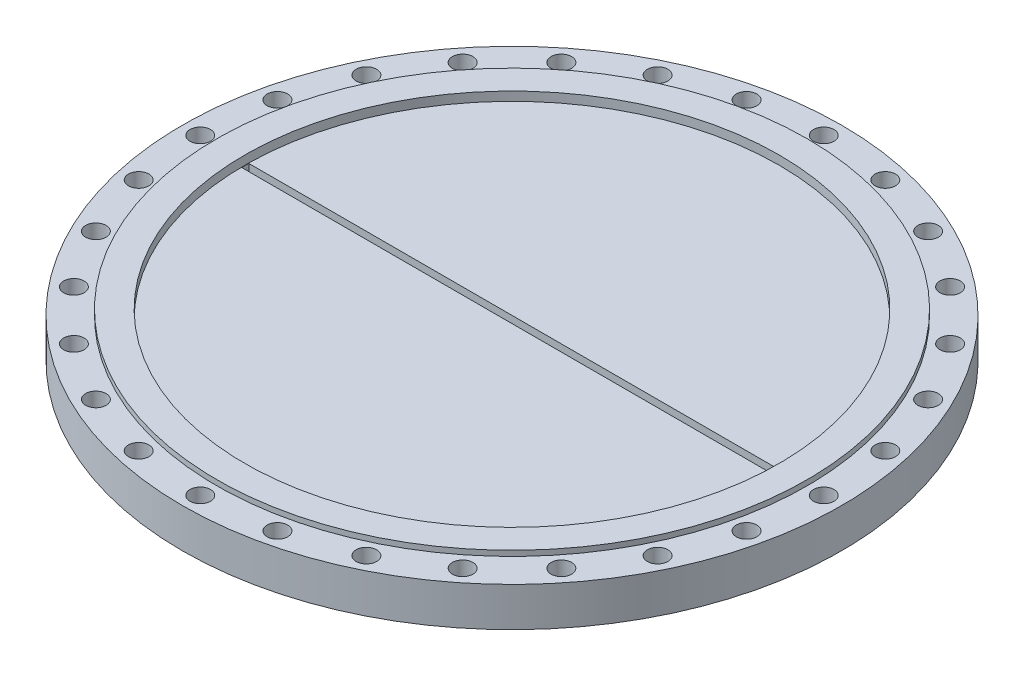
from build123d import *

# Parameters (mm, degrees)
SKETCH_2_R          = 11.5
CUT_EXTRUDE_1_DEPTH = 526.105703645
SKETCH_3_W          = 599
SKETCH_3_H          = 8
CUT_EXTRUDE_2_DEPTH = 10


with BuildPart() as part:
    # Эскиз1 → Повернуть1 (revolve)
    with BuildSketch(Plane.XY, mode=Mode.PRIVATE) as revolve_1_sk:
        Polygon((-300, 50), (-331.5, 50), (-331.5, 44), (-370, 44), (-370, 0), (0, 0), (0, 40), (-300, 40), align=None)
    revolve(revolve_1_sk.sketch.rotate(Axis((0, 0, 0), (0, 1, 0)), 270), axis=Axis((0, 0, 0), (0, 1, 0)))

    # Эскиз2 → Вырез-Вытянуть1 (cut, through all)
    with BuildSketch(Plane(origin=(0, 44, 0), x_dir=(1, 0, 0), z_dir=(0, 1, 0))):
        with Locations(Location((0, 350, 0), (0, 0, 270))):
            Circle(SKETCH_2_R)
        with Locations(Location((77.882326885, 341.224769264, 0), (0, 0, 270))):
            Circle(SKETCH_2_R)
        with Locations(Location((151.859308691, 315.339103766, 0), (0, 0, 270))):
            Circle(SKETCH_2_R)
        with Locations(Location((218.221430651, 273.641018864, 0), (0, 0, 270))):
            Circle(SKETCH_2_R)
        with Locations(Location((273.641018864, 218.221430651, 0), (0, 0, 270))):
            Circle(SKETCH_2_R)
        with Locations(Location((315.339103766, 151.859308691, 0), (0, 0, 270))):
            Circle(SKETCH_2_R)
        with Locations(Location((341.224769264, 77.882326885, 0), (0, 0, 270))):
            Circle(SKETCH_2_R)
        with Locations(Location((350, 0, 0), (0, 0, 270))):
            Circle(SKETCH_2_R)
        with Locations(Location((341.224769264, -77.882326885, 0), (0, 0, 270))):
            Circle(SKETCH_2_R)
        with Locations(Location((315.339103766, -151.859308691, 0), (0, 0, 270))):
            Circle(SKETCH_2_R)
        with Locations(Location((273.641018864, -218.221430651, 0), (0, 0, 270))):
            Circle(SKETCH_2_R)
        with Locations(Location((218.221430651, -273.641018864, 0), (0, 0, 270))):
            Circle(SKETCH_2_R)
        with Locations(Location((151.859308691, -315.339103766, 0), (0, 0, 270))):
            Circle(SKETCH_2_R)
        with Locations(Location((77.882326885, -341.224769264, 0), (0, 0, 270))):
            Circle(SKETCH_2_R)
        with Locations(Location((0, -350, 0), (0, 0, 270))):
            Circle(SKETCH_2_R)
        with Locations(Location((-77.882326885, -341.224769264, 0), (0, 0, 270))):
            Circle(SKETCH_2_R)
        with Locations(Location((-151.859308691, -315.339103766, 0), (0, 0, 270))):
            Circle(SKETCH_2_R)
        with Locations(Location((-218.221430651, -273.641018864, 0), (0, 0, 270))):
            Circle(SKETCH_2_R)
        with Locations(Location((-273.641018864, -218.221430651, 0), (0, 0, 270))):
            Circle(SKETCH_2_R)
        with Locations(Location((-315.339103766, -151.859308691, 0), (0, 0, 270))):
            Circle(SKETCH_2_R)
        with Locations(Location((-341.224769264, -77.882326885, 0), (0, 0, 270))):
            Circle(SKETCH_2_R)
        with Locations(Location((-350, 0, 0), (0, 0, 270))):
            Circle(SKETCH_2_R)
        with Locations(Location((-341.224769264, 77.882326885, 0), (0, 0, 270))):
            Circle(SKETCH_2_R)
        with Locations(Location((-315.339103766, 151.859308691, 0), (0, 0, 270))):
            Circle(SKETCH_2_R)
        with Locations(Location((-273.641018864, 218.221430651, 0), (0, 0, 270))):
            Circle(SKETCH_2_R)
        with Locations(Location((-218.221430651, 273.641018864, 0), (0, 0, 270))):
            Circle(SKETCH_2_R)
        with Locations(Location((-151.859308691, 315.339103766, 0), (0, 0, 270))):
            Circle(SKETCH_2_R)
        with Locations(Location((-77.882326885, 341.224769264, 0), (0, 0, 270))):
            Circle(SKETCH_2_R)
    extrude(amount=-CUT_EXTRUDE_1_DEPTH, mode=Mode.SUBTRACT)

    # Эскиз3 → Вырез-Вытянуть2 (cut)
    with BuildSketch(Plane(origin=(0, 40, 0), x_dir=(1, 0, 0), z_dir=(0, 1, 0))):
        Rectangle(SKETCH_3_W, SKETCH_3_H)
    extrude(amount=-CUT_EXTRUDE_2_DEPTH, mode=Mode.SUBTRACT)


solid = part.part
